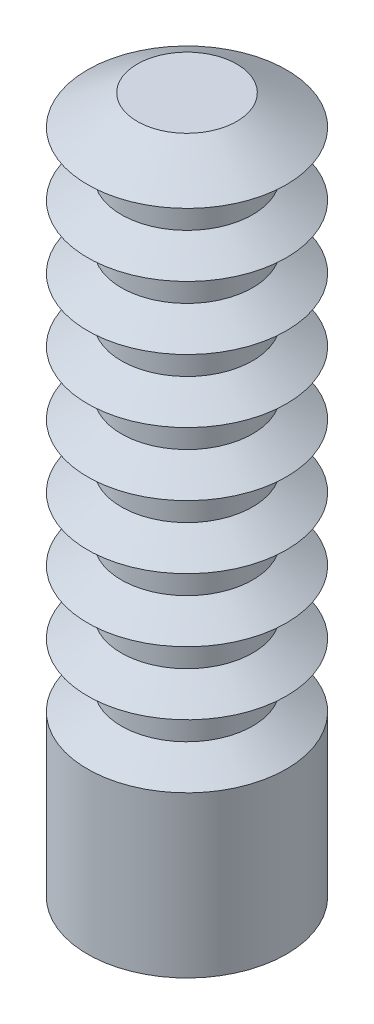
from build123d import *


with BuildPart() as part:
    # Sketch1 → Revolve1 (revolve)
    with BuildSketch(Plane.XY, mode=Mode.PRIVATE) as revolve1_sk:
        Polygon((-0.431630681, 32.7), (-2.131630681, 31.68), (-2.131630681, 30.54), (-0.431630681, 29.52), (-2.131630681, 28.5), (-2.131630681, 27.36), (-0.431630681, 26.34), (-2.131630681, 25.32), (-2.131630681, 24.18), (-0.431630681, 23.16), (-2.131630681, 22.14), (-2.131630681, 21), (-0.431630681, 19.98), (-2.131630681, 18.96), (-2.131630681, 17.82), (-0.431630681, 16.8), (-2.131630681, 15.78), (-2.131630681, 14.64), (-0.431630681, 13.62), (-2.131630681, 12.6), (-2.131630681, 11.46), (-0.431630681, 10.44), (-2.131630681, 9.42), (-2.131630681, 8.28), (-0.431630681, 7.26), (-0.431630681, 0), (-0.431630681, -0.8), (-5.431630681, -0.8), (-5.431630681, 0), (-1.231630681, 0), (-1.231630681, 6.795995819), (-1.995791511, 7.26), (-3.138866015, 7.96), (-3.138866015, 9.754155298), (-1.995791511, 10.44), (-3.138866015, 11.14), (-3.138866015, 12.934155298), (-1.995791511, 13.62), (-3.138866015, 14.32), (-3.138866015, 16.114155298), (-1.995791511, 16.8), (-3.138866015, 17.5), (-3.138866015, 19.294155298), (-1.995791511, 19.98), (-3.138866015, 20.68), (-3.138866015, 22.474155298), (-1.995791511, 23.16), (-3.138866015, 23.86), (-3.138866015, 25.654155298), (-1.995791511, 26.34), (-3.138866015, 27.04), (-3.138866015, 28.834155298), (-1.995791511, 29.52), (-3.138866015, 30.22), (-3.138866015, 32.014155298), (-1.995791511, 32.7), (-3.138866015, 33.4), (-5.431630681, 33.4), (-5.431630681, 34.2), (-2.931630681, 34.2), align=None)
    revolve(revolve1_sk.sketch.rotate(Axis((-5.431630681, 34.2, 0), (0, -1, 0)), 180), axis=Axis((-5.431630681, 34.2, 0), (0, -1, 0)))


solid = part.part
